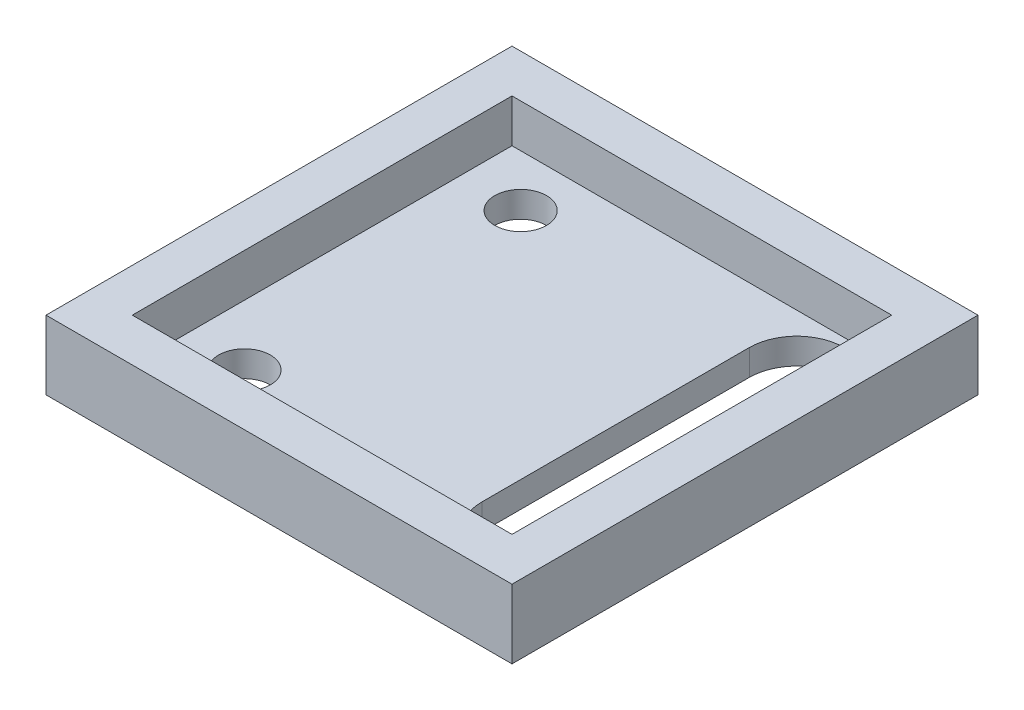
from build123d import *

# Parameters (mm, degrees)
SKETCH2_W           = 27
SKETCH2_H           = 27
BOSS_EXTRUDE1_DEPTH = 4
SKETCH5_W           = 22
SKETCH5_H           = 22
CUT_EXTRUDE2_DEPTH  = 2.5
SKETCH3_R           = 1.5
CUT_EXTRUDE3_DEPTH  = 10
CUT_EXTRUDE4_DEPTH  = 10


with BuildPart() as part:
    # Sketch2 → Boss-Extrude1 (new body)
    with BuildSketch(Plane(origin=(0, 0, 0), x_dir=(1, 0, 0), z_dir=(0, 1, 0))):
        with Locations((13.5, 13.5)):
            Rectangle(SKETCH2_W, SKETCH2_H)
    extrude(amount=BOSS_EXTRUDE1_DEPTH)

    # Sketch5 → Cut-Extrude2 (cut)
    with BuildSketch(Plane(origin=(0, 4, 0), x_dir=(1, 0, 0), z_dir=(0, 1, 0))):
        with Locations((13.5, 13.5)):
            Rectangle(SKETCH5_W, SKETCH5_H)
    extrude(amount=-CUT_EXTRUDE2_DEPTH, mode=Mode.SUBTRACT)

    # Sketch3 → Cut-Extrude3 (cut)
    with BuildSketch(Plane(origin=(0, 0, 0), x_dir=(-1, 0, 0), z_dir=(0, -1, 0))):
        with Locations(Location((-6, 21.5, 0), (0, 0, 90))):
            Circle(SKETCH3_R)
        with Locations(Location((-6, 5.5, 0), (0, 0, 90))):
            Circle(SKETCH3_R)
    extrude(amount=-CUT_EXTRUDE3_DEPTH, mode=Mode.SUBTRACT)

    # Sketch6 → Cut-Extrude4 (cut)
    with BuildSketch(Plane(origin=(0, 1.5, 0), x_dir=(1, 0, 0), z_dir=(0, 1, 0))):
        with BuildLine():
            ThreePointArc((22.25, 24), (20.305456352, 23.194543648), (19.5, 21.25))
            Line((19.5, 21.25), (19.5, 5.75))
            ThreePointArc((19.5, 5.75), (20.305456352, 3.805456352), (22.25, 3))
            ThreePointArc((22.25, 3), (23.865824645, 3.9734162), (24.5, 5.75))
            Line((24.5, 5.75), (24.5, 21.25))
            ThreePointArc((24.5, 21.25), (23.865824645, 23.0265838), (22.25, 24))
        make_face()
    extrude(amount=-CUT_EXTRUDE4_DEPTH, mode=Mode.SUBTRACT)


solid = part.part
